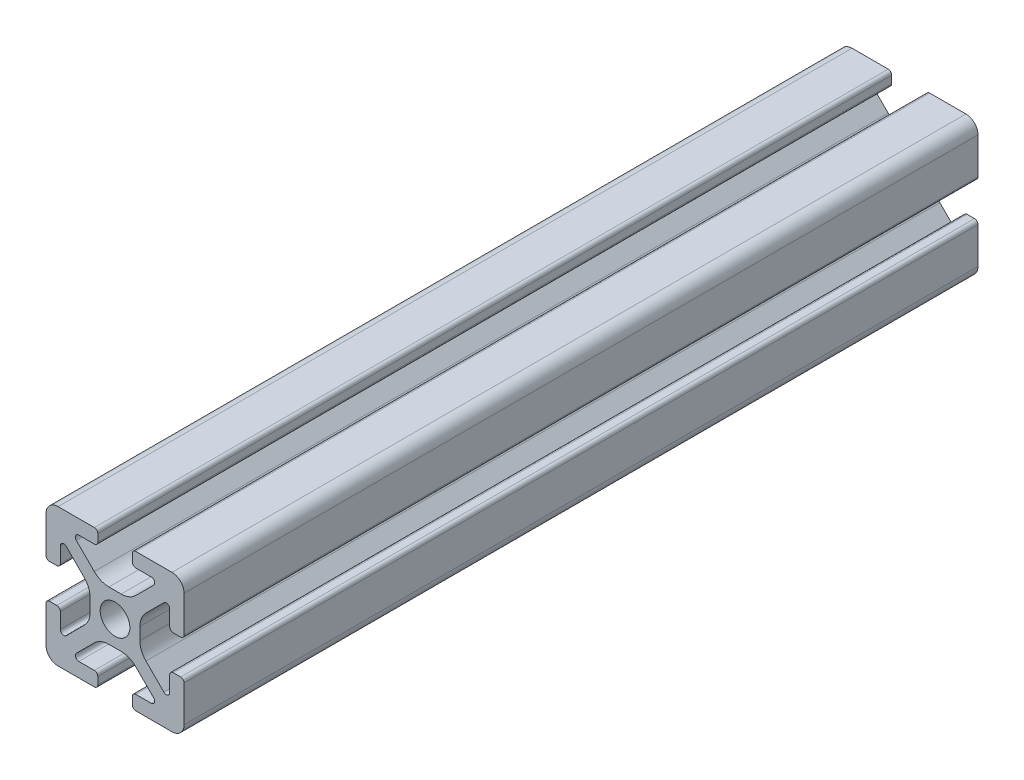
from build123d import *

# Parameters (mm, degrees)
BOSS_EXTRUDE1_DEPTH = 57.5


with BuildPart() as part:
    # Sketch4 → Boss-Extrude1 (new, symmetric)
    with BuildSketch(Plane.XY):
        with BuildLine():
            Line((3, -10), (8.25, -10))
            ThreePointArc((8.25, -10), (9.487436867, -9.487436867), (10, -8.25))
            Line((10, -8.25), (10, -3))
            ThreePointArc((10, -3), (9.853553391, -2.646446609), (9.5, -2.5))
            Line((9.5, -2.5), (8.424621202, -2.5))
            ThreePointArc((8.424621202, -2.5), (8.071067812, -2.646446609), (7.924621202, -3))
            Line((7.924621202, -3), (7.924621202, -5.25))
            ThreePointArc((7.924621202, -5.25), (7.615962919, -5.711939766), (7.071067812, -5.603553391))
            Line((7.071067812, -5.603553391), (4.478679656, -3.011165235))
            ThreePointArc((4.478679656, -3.011165235), (3.828361402, -2.037895189), (3.6, -0.889844892))
            Line((3.6, -0.889844892), (3.6, 0))
            Line((3.6, 0), (2.15, 0))
            ThreePointArc((2.15, 0), (1.52027958, -1.52027958), (0, -2.15))
            Line((0, -2.15), (0, -3.6))
            Line((0, -3.6), (0.889844892, -3.6))
            ThreePointArc((0.889844892, -3.6), (2.037895189, -3.828361402), (3.011165235, -4.478679656))
            Line((3.011165235, -4.478679656), (5.603553391, -7.071067812))
            ThreePointArc((5.603553391, -7.071067812), (5.711939766, -7.615962919), (5.25, -7.924621202))
            Line((5.25, -7.924621202), (3, -7.924621202))
            ThreePointArc((3, -7.924621202), (2.646446609, -8.071067812), (2.5, -8.424621202))
            Line((2.5, -8.424621202), (2.5, -9.5))
            ThreePointArc((2.5, -9.5), (2.646446609, -9.853553391), (3, -10))
        make_face()
    extrude(amount=BOSS_EXTRUDE1_DEPTH, both=True)

    # Mirror1: part across plane


with BuildPart() as part_1:
    add(part.part)
    add(part.part.mirror(Plane(origin=(0, 0, 0), x_dir=(0, 0, 1), z_dir=(1, 0, 0))))

    # Mirror2: part across plane


with BuildPart() as part_2:
    add(part_1.part)
    add(part_1.part.mirror(Plane.ZX))


solid = part_2.part
